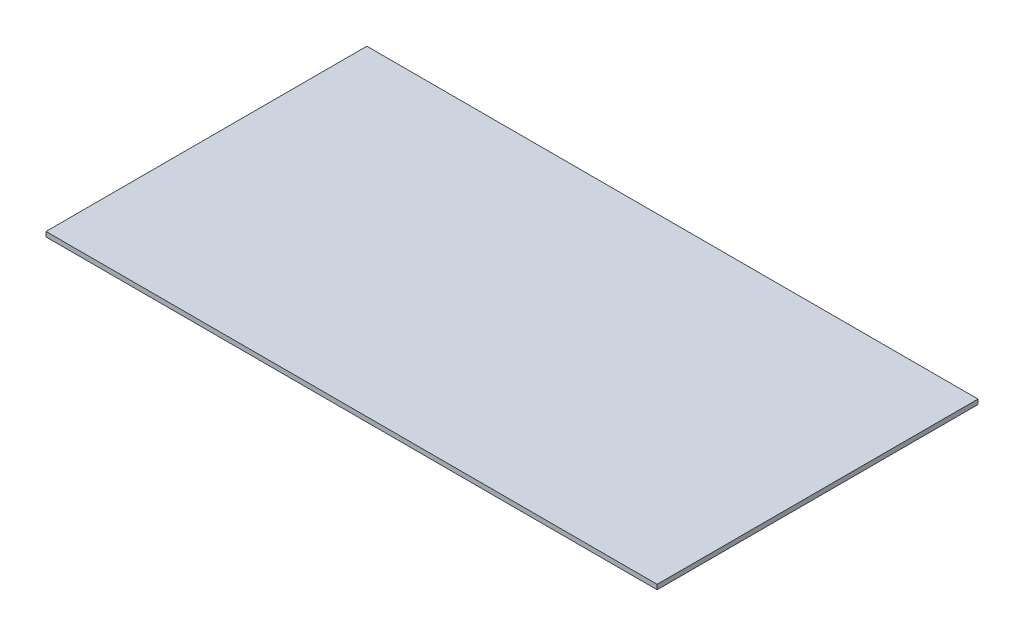
from build123d import *

# Parameters (mm, degrees)
SKETCH1_W           = 32
SKETCH1_H           = 16.8
BOSS_EXTRUDE1_DEPTH = 0.25


with BuildPart() as part:
    # Sketch1 → Boss-Extrude1 (new body)
    with BuildSketch(Plane(origin=(0, 0, 0), x_dir=(1, 0, 0), z_dir=(0, 1, 0))):
        with Locations((-10.762889475, 10.597947241)):
            Rectangle(SKETCH1_W, SKETCH1_H)
    extrude(amount=BOSS_EXTRUDE1_DEPTH)


solid = part.part
